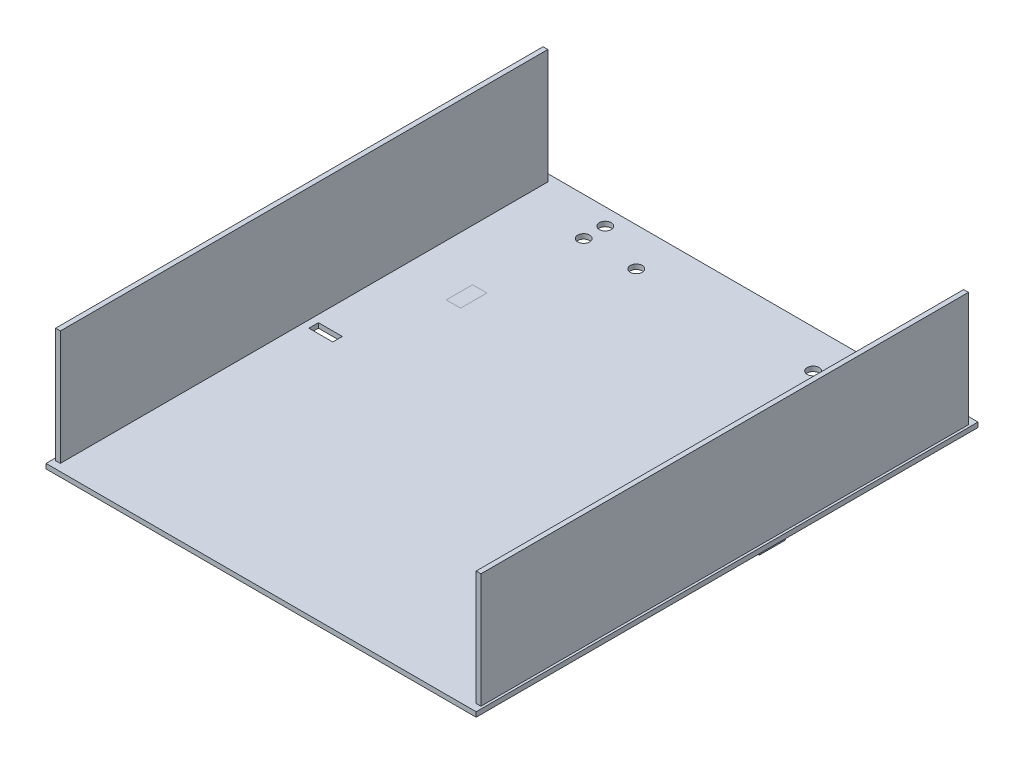
from build123d import *

# Parameters (mm, degrees)
SKETCH1_W              = 180
SKETCH1_H              = 210
SKETCH1_R              = 2.5
SKETCH1_W_2            = 10
SKETCH1_H_2            = 4
SKETCH1_W_3            = 6
SKETCH1_H_3            = 11
SKETCH1_W_4            = 2
SKETCH1_H_4            = 204
MAINBODY_DEPTH         = 2
SAYAPRODA_DEPTH        = 2
SAYAPRODA_DEPTH_BACK   = 25
SKETCH1_4_W            = 6
SKETCH1_4_H            = 11
SAYAPRODA_2_DEPTH      = 2
SAYAPRODA_2_DEPTH_BACK = 25
SKETCH9_W              = 1.5
SKETCH9_H              = 155.5
HOLE1_AT_2_COUNT       = 2
HOLE1_AT_2_PITCH       = 11
HOLE1_AT_3_COUNT       = 2
HOLE1_AT_3_PITCH       = 12.504350098
HOLE1_AT_4_COUNT       = 2
HOLE1_AT_4_PITCH       = 13.992231398
HOLE1_AT_5_COUNT       = 2
HOLE1_AT_5_PITCH       = 15.354775431
SKETCH1_5_W            = 2
SKETCH1_5_H            = 204
BOSS_EXTRUDE4_DEPTH    = 50


with BuildPart() as part:
    # Sketch1 → MainBody (new body)
    with BuildSketch(Plane(origin=(0, 0, 0), x_dir=(1, 0, 0), z_dir=(0, 1, 0))):
        Rectangle(SKETCH1_W, SKETCH1_H)
        with Locations((-59, 98)):
            Circle(SKETCH1_R, mode=Mode.SUBTRACT)
        with Locations((-59, 89)):
            Circle(SKETCH1_R, mode=Mode.SUBTRACT)
        with Locations((-37, 89)):
            Circle(SKETCH1_R, mode=Mode.SUBTRACT)
        with Locations((59, 98)):
            Circle(SKETCH1_R, mode=Mode.SUBTRACT)
        with Locations((59, 89)):
            Circle(SKETCH1_R, mode=Mode.SUBTRACT)
        with Locations((37, 89)):
            Circle(SKETCH1_R, mode=Mode.SUBTRACT)
        with Locations((79, 1)):
            Rectangle(SKETCH1_W_2, SKETCH1_H_2, mode=Mode.SUBTRACT)
        with Locations((-79, 1)):
            Rectangle(SKETCH1_W_2, SKETCH1_H_2, mode=Mode.SUBTRACT)
        with Locations((-62.5, 43.5)):
            Rectangle(SKETCH1_W_3, SKETCH1_H_3, mode=Mode.SUBTRACT)
        with Locations((62.5, 43.5)):
            Rectangle(SKETCH1_W_3, SKETCH1_H_3, mode=Mode.SUBTRACT)
        with Locations((-88, 0)):
            Rectangle(SKETCH1_W_4, SKETCH1_H_4, mode=Mode.SUBTRACT)
        with Locations((88, 0)):
            Rectangle(SKETCH1_W_4, SKETCH1_H_4, mode=Mode.SUBTRACT)
    extrude(amount=MAINBODY_DEPTH)

    # Sketch1<5> → Boss-Extrude4 (add)
    with BuildSketch(Plane(origin=(0, 0, 0), x_dir=(1, 0, 0), z_dir=(0, 1, 0))):
        with Locations((-88, 0)):
            Rectangle(SKETCH1_5_W, SKETCH1_5_H)
        with Locations((88, 0)):
            Rectangle(SKETCH1_5_W, SKETCH1_5_H)
    extrude(amount=BOSS_EXTRUDE4_DEPTH)


with BuildPart() as body_2:
    # Sketch1<4> → SayapRoda (new, two sides: drawn at the far end of the back side and taken through both)
    with BuildSketch(Plane(origin=(0, 0, 0), x_dir=(1, 0, 0), z_dir=(0, 1, 0)).offset(-SAYAPRODA_DEPTH_BACK)):
        with Locations((-62.5, 43.5)):
            Rectangle(SKETCH1_4_W, SKETCH1_4_H)
    extrude(amount=SAYAPRODA_DEPTH + SAYAPRODA_DEPTH_BACK)


with BuildPart() as body_3:
    # Sketch1<4> → SayapRoda 2 (new, two sides: drawn at the far end of the back side and taken through both)
    with BuildSketch(Plane(origin=(0, 0, 0), x_dir=(1, 0, 0), z_dir=(0, 1, 0)).offset(-SAYAPRODA_2_DEPTH_BACK)):
        with Locations((62.5, 43.5)):
            Rectangle(SKETCH1_4_W, SKETCH1_4_H)
    extrude(amount=SAYAPRODA_2_DEPTH + SAYAPRODA_2_DEPTH_BACK)


with BuildPart() as hole1_tool:
    # Sketch9 → Hole1 (revolve)
    with BuildSketch(Plane(origin=(65.5, -20.233052412, -43.5), x_dir=(0, 0, -1), z_dir=(0, 1, 0))):
        with Locations((0.75, 77.75)):
            Rectangle(SKETCH9_W, SKETCH9_H)
    hole1 = revolve(axis=Axis((-44.5, -20.233052412, -43.5), (1, 0, 0)))


with BuildPart() as body_2_1:
    add(body_2.part)

    # Hole1: cut by hole1_tool
    add(hole1_tool.part, mode=Mode.SUBTRACT)


with BuildPart() as body_3_1:
    add(body_3.part)

    # Hole1: cut by hole1_tool
    add(hole1_tool.part, mode=Mode.SUBTRACT)


with BuildPart() as hole1_at_2_tool:
    # Hole1 at 2: Hole1 ×2
    with Locations(*[Vector(0, 0.9999876242984519, 0.004975062807454704) * (i * HOLE1_AT_2_PITCH) for i in range(1, HOLE1_AT_2_COUNT)]):
        add(hole1)


with BuildPart() as body_2_2:
    add(body_2_1.part)

    # Hole1 at 2: cut by hole1_at_2_tool
    add(hole1_at_2_tool.part, mode=Mode.SUBTRACT)


with BuildPart() as body_3_2:
    add(body_3_1.part)

    # Hole1 at 2: cut by hole1_at_2_tool
    add(hole1_at_2_tool.part, mode=Mode.SUBTRACT)


with BuildPart() as hole1_at_3_tool:
    # Hole1 at 3: Hole1 ×2
    with Locations(*[(0, i * HOLE1_AT_3_PITCH, 0) for i in range(1, HOLE1_AT_3_COUNT)]):
        add(hole1)


with BuildPart() as body_2_3:
    add(body_2_2.part)

    # Hole1 at 3: cut by hole1_at_3_tool
    add(hole1_at_3_tool.part, mode=Mode.SUBTRACT)


with BuildPart() as body_3_3:
    add(body_3_2.part)

    # Hole1 at 3: cut by hole1_at_3_tool
    add(hole1_at_3_tool.part, mode=Mode.SUBTRACT)


with BuildPart() as hole1_at_4_tool:
    # Hole1 at 4: Hole1 ×2
    with Locations(*[(0, i * HOLE1_AT_4_PITCH, 0) for i in range(1, HOLE1_AT_4_COUNT)]):
        add(hole1)


with BuildPart() as body_2_4:
    add(body_2_3.part)

    # Hole1 at 4: cut by hole1_at_4_tool
    add(hole1_at_4_tool.part, mode=Mode.SUBTRACT)


with BuildPart() as body_3_4:
    add(body_3_3.part)

    # Hole1 at 4: cut by hole1_at_4_tool
    add(hole1_at_4_tool.part, mode=Mode.SUBTRACT)


with BuildPart() as hole1_at_5_tool:
    # Hole1 at 5: Hole1 ×2
    with Locations(*[(0, i * HOLE1_AT_5_PITCH, 0) for i in range(1, HOLE1_AT_5_COUNT)]):
        add(hole1)


with BuildPart() as body_2_5:
    add(body_2_4.part)

    # Hole1 at 5: cut by hole1_at_5_tool
    add(hole1_at_5_tool.part, mode=Mode.SUBTRACT)


with BuildPart() as body_3_5:
    add(body_3_4.part)

    # Hole1 at 5: cut by hole1_at_5_tool
    add(hole1_at_5_tool.part, mode=Mode.SUBTRACT)


solid = Compound([part.part, body_2_5.part, body_3_5.part])
